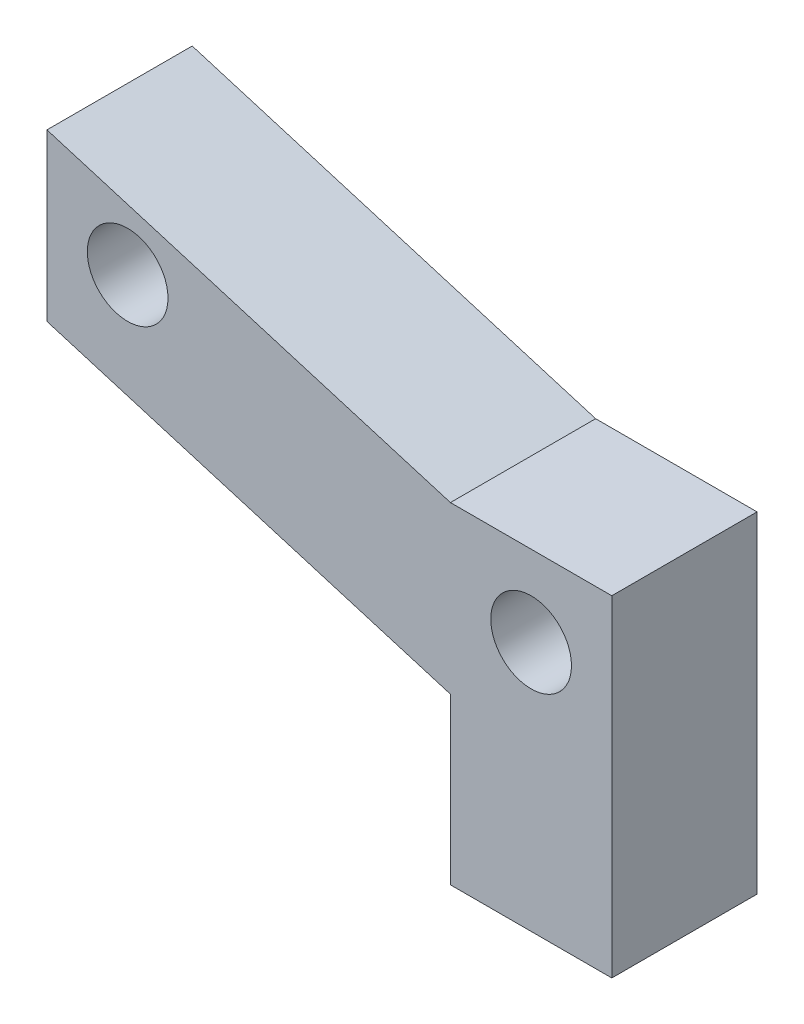
from build123d import *

# Parameters (mm, degrees)
BOSS_EXTRUDE1_DEPTH = 9
SKETCH3_R           = 2.5
CUT_EXTRUDE1_DEPTH  = 9


with BuildPart() as part:
    # Sketch2 → Boss-Extrude1 (new body)
    with BuildSketch(Plane.XY):
        Polygon((-15.81579683, -97.193157961), (-15.81579683, -107.474376779), (9.18420317, -114.974376779), (9.18420317, -125.206503808), (19.18420317, -125.206503808), (19.18420317, -114.974376779), (19.18420317, -104.693157961), (9.18420317, -104.693157961), align=None)
    extrude(amount=BOSS_EXTRUDE1_DEPTH)

    # Sketch3 → Cut-Extrude1 (cut)
    with BuildSketch(Plane.XY.offset(9)):
        with Locations((14.18420317, -109.693157961)):
            Circle(SKETCH3_R)
        with Locations((-10.81579683, -102.474376779)):
            Circle(SKETCH3_R)
    extrude(amount=-CUT_EXTRUDE1_DEPTH, mode=Mode.SUBTRACT)


solid = part.part
